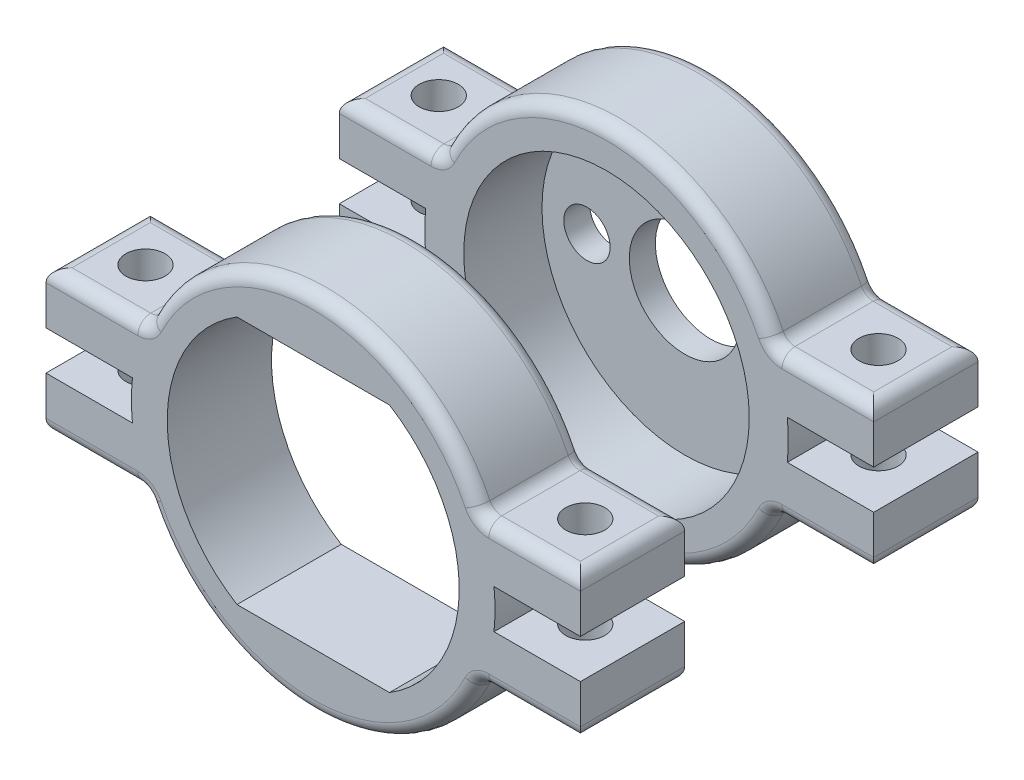
from build123d import *

# Parameters (mm, degrees)
SALIENTE_EXTRUIR1_DEPTH = 8
CROQUIS2_R              = 10.95
CORTAR_EXTRUIR1_DEPTH   = 6
CROQUIS3_R              = 4.25
CROQUIS3_R_2            = 1.775
CORTAR_EXTRUIR2_DEPTH   = 3.5
SALIENTE_EXTRUIR2_DEPTH = 14.5
SALIENTE_EXTRUIR3_DEPTH = 8
CORTAR_EXTRUIR3_DEPTH   = 8
CROQUIS8_R              = 1.5
CORTAR_EXTRUIR4_DEPTH   = 44.411432826
CROQUIS9_W              = 3.5
CROQUIS9_H              = 30.5
CORTAR_EXTRUIR6_DEPTH   = 44.411432826
CROQUIS10_W             = 7.6799961
CROQUIS10_H             = 14.5
CORTAR_EXTRUIR7_DEPTH   = 42.578870836
REDONDEO3_R             = 1
REDONDEO4_R             = 1


with BuildPart() as part:
    # Croquis1 → Saliente-Extruir1 (new body)
    with BuildSketch(Plane.XY):
        with BuildLine():
            Line((-13.869120376, 1.5), (-24, 1.5))
            Line((-24, 1.5), (-24, 5.5))
            Line((-24, 5.5), (-12.8200039, 5.5))
            ThreePointArc((-12.8200039, 5.5), (0, 13.95), (12.8200039, 5.5))
            Line((12.8200039, 5.5), (24, 5.5))
            Line((24, 5.5), (24, 1.5))
            Line((24, 1.5), (13.869120376, 1.5))
            ThreePointArc((13.869120376, 1.5), (13.95, 0), (13.869120376, -1.5))
            Line((13.869120376, -1.5), (24, -1.5))
            Line((24, -1.5), (24, -5.5))
            Line((24, -5.5), (12.8200039, -5.5))
            ThreePointArc((12.8200039, -5.5), (0, -13.95), (-12.8200039, -5.5))
            Line((-12.8200039, -5.5), (-24, -5.5))
            Line((-24, -5.5), (-24, -1.5))
            Line((-24, -1.5), (-13.869120376, -1.5))
            ThreePointArc((-13.869120376, -1.5), (-13.95, 0), (-13.869120376, 1.5))
        make_face()
    extrude(amount=SALIENTE_EXTRUIR1_DEPTH)

    # Croquis2 → Cortar-Extruir1 (cut)
    with BuildSketch(Plane.XY.offset(8)):
        Circle(CROQUIS2_R)
    extrude(amount=-CORTAR_EXTRUIR1_DEPTH, mode=Mode.SUBTRACT)

    # Croquis3 → Cortar-Extruir2 (cut)
    with BuildSketch(Plane.XY.offset(2)):
        Circle(CROQUIS3_R)
        with Locations((-7.5, 0)):
            Circle(CROQUIS3_R_2)
        with Locations((7.5, 0)):
            Circle(CROQUIS3_R_2)
    extrude(amount=-CORTAR_EXTRUIR2_DEPTH, mode=Mode.SUBTRACT)

    # Croquis4 → Saliente-Extruir2 (add)
    with BuildSketch(Plane.XY.offset(8)):
        with BuildLine():
            Line((-12.8200039, 5.5), (-24, 5.5))
            Line((-24, 5.5), (-24, 1.5))
            Line((-24, 1.5), (-13.869120376, 1.5))
            ThreePointArc((-13.869120376, 1.5), (-13.49360362, 3.539090469), (-12.8200039, 5.5))
        make_face()
        with BuildLine():
            Line((-13.869120376, -1.5), (-24, -1.5))
            Line((-24, -1.5), (-24, -5.5))
            Line((-24, -5.5), (-12.8200039, -5.5))
            ThreePointArc((-12.8200039, -5.5), (-13.49360362, -3.539090469), (-13.869120376, -1.5))
        make_face()
        with BuildLine():
            Line((24, -5.5), (12.8200039, -5.5))
            ThreePointArc((12.8200039, -5.5), (13.49360362, -3.539090469), (13.869120376, -1.5))
            Line((13.869120376, -1.5), (24, -1.5))
            Line((24, -1.5), (24, -5.5))
        make_face()
        with BuildLine():
            Line((24, 1.5), (13.869120376, 1.5))
            ThreePointArc((13.869120376, 1.5), (13.49360362, 3.539090469), (12.8200039, 5.5))
            Line((12.8200039, 5.5), (24, 5.5))
            Line((24, 5.5), (24, 1.5))
        make_face()
    extrude(amount=SALIENTE_EXTRUIR2_DEPTH)

    # Croquis6 → Saliente-Extruir3 (add)
    with BuildSketch(Plane.XY.offset(22.5)):
        with BuildLine():
            Line((-12.8200039, 5.5), (-24, 5.5))
            Line((-24, 5.5), (-24, 1.5))
            Line((-24, 1.5), (-13.869120376, 1.5))
            ThreePointArc((-13.869120376, 1.5), (-13.95, 0), (-13.869120376, -1.5))
            Line((-13.869120376, -1.5), (-24, -1.5))
            Line((-24, -1.5), (-24, -5.5))
            Line((-24, -5.5), (-12.8200039, -5.5))
            ThreePointArc((-12.8200039, -5.5), (0, -13.95), (12.8200039, -5.5))
            Line((12.8200039, -5.5), (24, -5.5))
            Line((24, -5.5), (24, -1.5))
            Line((24, -1.5), (13.869120376, -1.5))
            ThreePointArc((13.869120376, -1.5), (13.95, 0), (13.869120376, 1.5))
            Line((13.869120376, 1.5), (24, 1.5))
            Line((24, 1.5), (24, 5.5))
            Line((24, 5.5), (12.8200039, 5.5))
            ThreePointArc((12.8200039, 5.5), (0, 13.95), (-12.8200039, 5.5))
        make_face()
    extrude(amount=SALIENTE_EXTRUIR3_DEPTH)

    # Croquis7 → Cortar-Extruir3 (cut)
    with BuildSketch(Plane.XY.offset(30.5)):
        with BuildLine():
            Line((-5.848709946, 9.551575366), (5.848709946, 9.551575366))
            ThreePointArc((5.848709946, 9.551575366), (11.2, 0), (5.848709946, -9.551575366))
            Line((5.848709946, -9.551575366), (-5.848709946, -9.551575366))
            ThreePointArc((-5.848709946, -9.551575366), (-11.2, 0), (-5.848709946, 9.551575366))
        make_face()
    extrude(amount=-CORTAR_EXTRUIR3_DEPTH, mode=Mode.SUBTRACT)

    # Croquis8 → Cortar-Extruir4 (cut, through all)
    with BuildSketch(Plane(origin=(0, 5.5, 0), x_dir=(1, 0, 0), z_dir=(0, 1, 0))):
        with Locations(Location((16.8700039, -26.5, 0), (0, 0, 180))):
            Circle(CROQUIS8_R)
        with Locations(Location((16.8700039, -4, 0), (0, 0, 180))):
            Circle(CROQUIS8_R)
        with Locations(Location((-16.8700039, -4, 0), (0, 0, 270))):
            Circle(CROQUIS8_R)
        with Locations(Location((-16.8700039, -26.5, 0), (0, 0, 270))):
            Circle(CROQUIS8_R)
    extrude(amount=-CORTAR_EXTRUIR4_DEPTH, mode=Mode.SUBTRACT)

    # Croquis9 → Cortar-Extruir6 (cut, through all)
    with BuildSketch(Plane(origin=(0, 5.5, 0), x_dir=(1, 0, 0), z_dir=(0, 1, 0))):
        with Locations((22.25, -15.25)):
            Rectangle(CROQUIS9_W, CROQUIS9_H)
        with Locations((-22.25, -15.25)):
            Rectangle(CROQUIS9_W, CROQUIS9_H)
    extrude(amount=-CORTAR_EXTRUIR6_DEPTH, mode=Mode.SUBTRACT)

    # Croquis10 → Cortar-Extruir7 (cut, through all)
    with BuildSketch(Plane(origin=(0, 5.5, 0), x_dir=(1, 0, 0), z_dir=(0, 1, 0))):
        with Locations((-16.66000195, -15.25)):
            Rectangle(CROQUIS10_W, CROQUIS10_H)
        with Locations((16.66000195, -15.25)):
            Rectangle(CROQUIS10_W, CROQUIS10_H)
    extrude(amount=-CORTAR_EXTRUIR7_DEPTH, mode=Mode.SUBTRACT)


with BuildPart() as cortar_extruir7_piece_1:
    # of the separate pieces the step leaves, piece 1, a body of its own (cortar_extruir7_pieces)
    add(part.part.solids().sort_by_distance((-12.8200039, -5.5, 0))[0])

    # Redondeo3
    redondeo3_edges = [cortar_extruir7_piece_1.edges().sort_by_distance(p)[0] for p in [
        (20.5, -5.5, 4),
        (16.66000195, -5.5, 8),
        (12.8200039, -5.5, 4),
        (16.66000195, -5.5, 0),
        (16.66000195, 5.5, 0),
        (20.5, 5.5, 4),
        (0, 13.95, 8),
        (-16.66000195, 5.5, 8),
        (0, -13.95, 8),
        (0, 13.95, 0),
        (12.8200039, 5.5, 4),
        (-12.8200039, 5.5, 4),
        (-16.66000195, 5.5, 0),
        (-16.66000195, -5.5, 8),
        (-20.5, -5.5, 4),
        (-16.66000195, -5.5, 0),
        (0, -13.95, 0),
        (-12.8200039, -5.5, 4),
        (-20.5, 5.5, 4),
        (16.66000195, 5.5, 8),
    ]]
    fillet(redondeo3_edges, radius=REDONDEO3_R)


with BuildPart() as cortar_extruir7_piece_2:
    # of the separate pieces the step leaves, piece 2, a body of its own (cortar_extruir7_pieces)
    add(part.part.solids().sort_by_distance((-12.8200039, -5.5, 22.5))[0])

    # Redondeo4
    redondeo4_edges = [cortar_extruir7_piece_2.edges().sort_by_distance(p)[0] for p in [
        (0, 13.95, 22.5),
        (12.8200039, 5.5, 26.5),
        (-12.8200039, 5.5, 26.5),
        (0, -13.95, 22.5),
        (-12.8200039, -5.5, 26.5),
        (12.8200039, -5.5, 26.5),
        (0, 13.95, 30.5),
        (-16.66000195, 5.5, 30.5),
        (0, -13.95, 30.5),
        (16.66000195, -5.5, 30.5),
        (16.66000195, 5.5, 30.5),
        (-16.66000195, -5.5, 30.5),
        (-20.5, -5.5, 26.5),
        (-20.5, 5.5, 26.5),
        (-16.66000195, -5.5, 22.5),
        (-16.66000195, 5.5, 22.5),
        (20.5, 5.5, 26.5),
        (20.5, -5.5, 26.5),
        (16.66000195, -5.5, 22.5),
        (16.66000195, 5.5, 22.5),
    ]]
    fillet(redondeo4_edges, radius=REDONDEO4_R)


solid = Compound([cortar_extruir7_piece_1.part, cortar_extruir7_piece_2.part])
